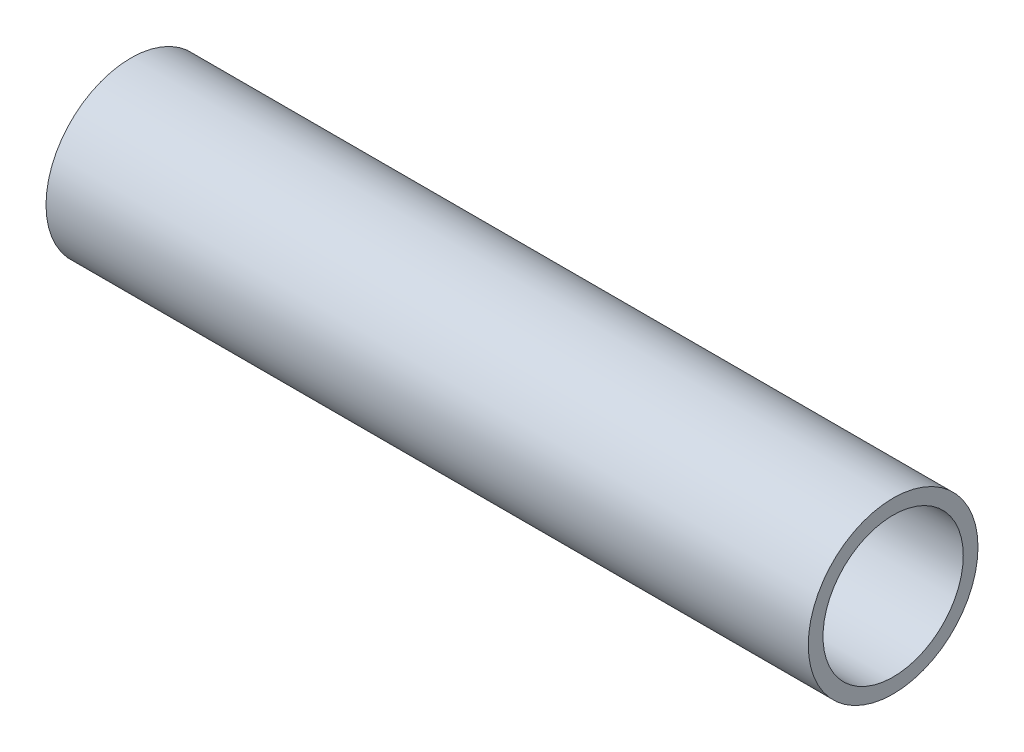
from build123d import *

# Parameters (mm, degrees)
SKETCH1_R           = 16.7
SKETCH1_R_2         = 13.8
BOSS_EXTRUDE1_DEPTH = 150


with BuildPart() as part:
    # Sketch1 → Boss-Extrude1 (new body)
    with BuildSketch(Plane(origin=(0, 0, 0), x_dir=(0, 0, -1), z_dir=(1, 0, 0))):
        Circle(SKETCH1_R)
        Circle(SKETCH1_R_2, mode=Mode.SUBTRACT)
    extrude(amount=BOSS_EXTRUDE1_DEPTH)


solid = part.part
